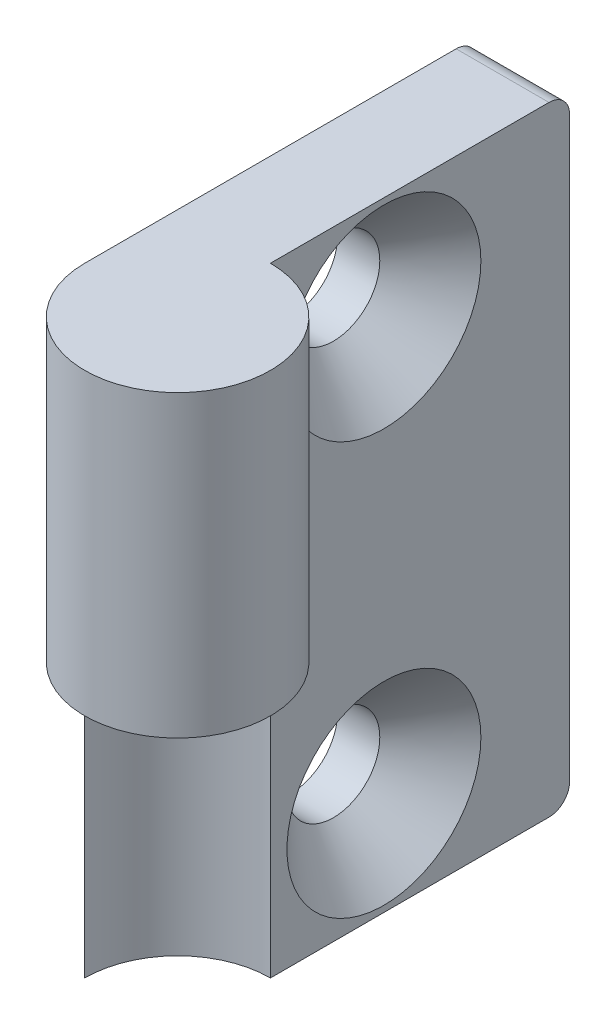
from build123d import *

# Parameters (mm, degrees)
SKETCH1_W                                    = 19
SKETCH1_H                                    = 30
PLATE_DEPTH                                  = 4.5
SKETCH2_R                                    = 4.5
CYLINDER_DEPTH                               = 14.5
CLEARANCE_START                              = -14.5
SKETCH2_2_R                                  = 4.5
CLEARANCE_DEPTH                              = 15.5
FILLET1_R                                    = 1
CSK_FOR_M4_COUNTERSUNK_FLAT_HEAD_SCR_2_COUNT = 2
CSK_FOR_M4_COUNTERSUNK_FLAT_HEAD_SCR_2_PITCH = 20


with BuildPart() as part:
    # Sketch1 → Plate (new body)
    with BuildSketch(Plane(origin=(0, 0, 0), x_dir=(0, 0, -1), z_dir=(1, 0, 0))):
        with Locations((9.5, 15)):
            Rectangle(SKETCH1_W, SKETCH1_H)
    extrude(amount=PLATE_DEPTH)

    # Sketch2 → Cylinder (add)
    with BuildSketch(Plane(origin=(0, 30, 0), x_dir=(1, 0, 0), z_dir=(0, 1, 0))):
        with Locations((4.5, 0)):
            Circle(SKETCH2_R)
    extrude(amount=-CYLINDER_DEPTH)

    # Sketch2<2> → Clearance (cut)
    with BuildSketch(Plane(origin=(0, 30, 0), x_dir=(1, 0, 0), z_dir=(0, 1, 0)).offset(CLEARANCE_START)):
        with Locations((4.5, 0)):
            Circle(SKETCH2_2_R)
    extrude(amount=-CLEARANCE_DEPTH, mode=Mode.SUBTRACT)

    # Fillet1
    fillet1_edges = [part.edges().sort_by_distance(p)[0] for p in [
        (2.25, 30, -19),
        (2.25, 0, -19),
    ]]
    fillet(fillet1_edges, radius=FILLET1_R)

    # Sketch4 → CSK for M4 Countersunk Flat Head Screw1 (revolve, cut)
    with BuildSketch(Plane(origin=(4.5, 25, -10), x_dir=(0, 0, -1), z_dir=(0, 1, 0))):
        Polygon((0, 0), (0, 4.5), (2.25, 4.5), (2.25, 2.45), (4.7, 0), align=None)
    csk_for_m4_countersunk_flat_head_screw1 = revolve(axis=Axis((10.85, 25, -10), (-1, 0, 0)), mode=Mode.SUBTRACT)

    # CSK for M4 Countersunk Flat Head Scr 2: CSK for M4 Countersunk Flat Head Screw1 ×2
    with Locations(*[(0, -i * CSK_FOR_M4_COUNTERSUNK_FLAT_HEAD_SCR_2_PITCH, 0) for i in range(1, CSK_FOR_M4_COUNTERSUNK_FLAT_HEAD_SCR_2_COUNT)]):
        add(csk_for_m4_countersunk_flat_head_screw1, mode=Mode.SUBTRACT)


solid = part.part
